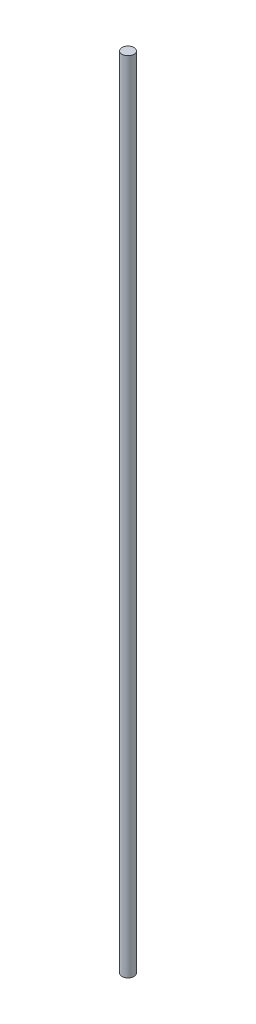
from build123d import *

# Parameters (mm, degrees)
SKETCH2_R           = 3.1
BOSS_EXTRUDE1_DEPTH = 415


with BuildPart() as part:
    # Sketch2 → Boss-Extrude1 (new body)
    with BuildSketch(Plane(origin=(0, 0, 0), x_dir=(1, 0, 0), z_dir=(0, 1, 0))):
        with Locations(Location((0, 0, 0), (0, 0, 270))):
            Circle(SKETCH2_R)
    extrude(amount=BOSS_EXTRUDE1_DEPTH)


solid = part.part
